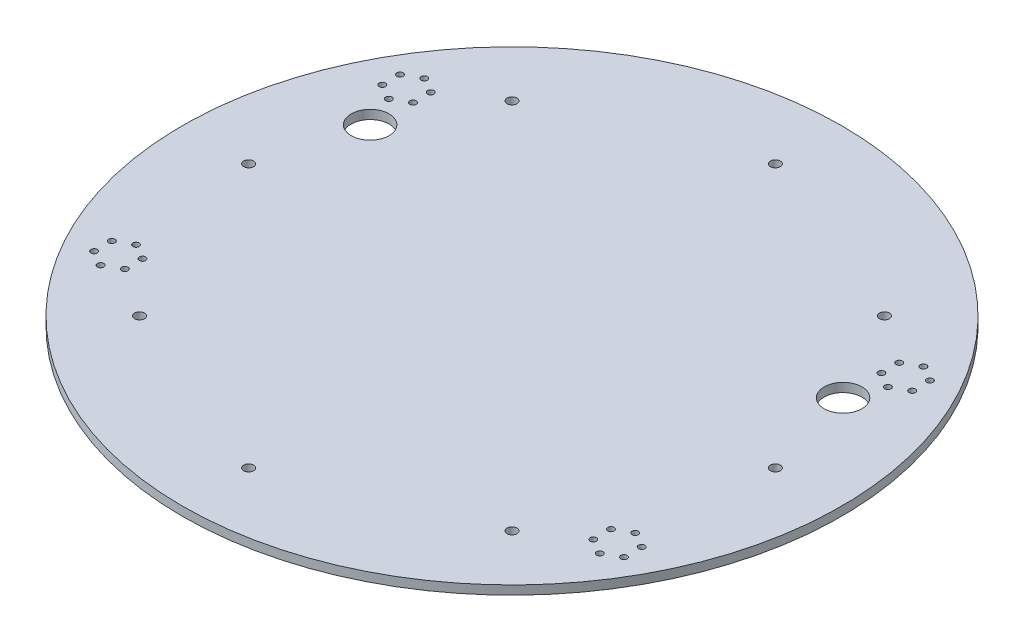
from build123d import *

# Parameters (mm, degrees)
SKETCH1_R           = 177
BOSS_EXTRUDE1_DEPTH = 4.7625
SKETCH2_R           = 1.7
CUT_EXTRUDE1_DEPTH  = 251.361102023
SKETCH3_R           = 2.667
ZIP_TIES_DEPTH      = 251.361102023
SKETCH4_R           = 10.16
WIRES_2_DEPTH       = 251.361102023


with BuildPart() as part:
    # Sketch1 → Boss-Extrude1 (new body)
    with BuildSketch(Plane(origin=(0, 0, 0), x_dir=(1, 0, 0), z_dir=(0, 1, 0))):
        with Locations(Location((0, 0, 0), (0, 0, 90))):
            Circle(SKETCH1_R)
    extrude(amount=BOSS_EXTRUDE1_DEPTH)

    # Sketch2 → Cut-Extrude1 (cut, through all)
    with BuildSketch(Plane(origin=(0, 4.7625, 0), x_dir=(1, 0, 0), z_dir=(0, 1, 0))):
        with Locations(Location((142.287973842, -82.15, 0), (0, 0, 270))):
            Circle(SKETCH2_R)
        with Locations(Location((134.039081871, -86.9125, 0), (0, 0, 270))):
            Circle(SKETCH2_R)
        with Locations(Location((125.7901899, -82.15, 0), (0, 0, 270))):
            Circle(SKETCH2_R)
        with Locations(Location((125.7901899, -72.625, 0), (0, 0, 270))):
            Circle(SKETCH2_R)
        with Locations(Location((134.039081871, -67.8625, 0), (0, 0, 270))):
            Circle(SKETCH2_R)
        with Locations(Location((142.287973842, -72.625, 0), (0, 0, 270))):
            Circle(SKETCH2_R)
        with Locations(Location((-142.287973842, -72.625, 0), (0, 0, 270))):
            Circle(SKETCH2_R)
        with Locations(Location((-134.039081871, -67.8625, 0), (0, 0, 270))):
            Circle(SKETCH2_R)
        with Locations(Location((-125.7901899, -72.625, 0), (0, 0, 270))):
            Circle(SKETCH2_R)
        with Locations(Location((-125.7901899, -82.15, 0), (0, 0, 270))):
            Circle(SKETCH2_R)
        with Locations(Location((-134.039081871, -86.9125, 0), (0, 0, 270))):
            Circle(SKETCH2_R)
        with Locations(Location((-142.287973842, -82.15, 0), (0, 0, 270))):
            Circle(SKETCH2_R)
        with Locations(Location((-142.287973842, 82.15, 0), (0, 0, 270))):
            Circle(SKETCH2_R)
        with Locations(Location((-134.039081871, 86.9125, 0), (0, 0, 270))):
            Circle(SKETCH2_R)
        with Locations(Location((-125.7901899, 82.15, 0), (0, 0, 270))):
            Circle(SKETCH2_R)
        with Locations(Location((-125.7901899, 72.625, 0), (0, 0, 270))):
            Circle(SKETCH2_R)
        with Locations(Location((-134.039081871, 67.8625, 0), (0, 0, 270))):
            Circle(SKETCH2_R)
        with Locations(Location((-142.287973842, 72.625, 0), (0, 0, 270))):
            Circle(SKETCH2_R)
        with Locations(Location((142.287973842, 72.625, 0), (0, 0, 270))):
            Circle(SKETCH2_R)
        with Locations(Location((134.039081871, 67.8625, 0), (0, 0, 270))):
            Circle(SKETCH2_R)
        with Locations(Location((125.7901899, 72.625, 0), (0, 0, 270))):
            Circle(SKETCH2_R)
        with Locations(Location((125.7901899, 82.15, 0), (0, 0, 270))):
            Circle(SKETCH2_R)
        with Locations(Location((134.039081871, 86.9125, 0), (0, 0, 270))):
            Circle(SKETCH2_R)
        with Locations(Location((142.287973842, 82.15, 0), (0, 0, 270))):
            Circle(SKETCH2_R)
    extrude(amount=-CUT_EXTRUDE1_DEPTH, mode=Mode.SUBTRACT)

    # Sketch3 → Zip Ties (cut, through all)
    with BuildSketch(Plane(origin=(0, 4.7625, 0), x_dir=(1, 0, 0), z_dir=(0, 1, 0))):
        with Locations(Location((0, -141.44, 0), (0, 0, 270))):
            Circle(SKETCH3_R)
        with Locations(Location((-100.013183131, -100.013183131, 0), (0, 0, 270))):
            Circle(SKETCH3_R)
        with Locations(Location((-141.44, 0, 0), (0, 0, 270))):
            Circle(SKETCH3_R)
        with Locations(Location((-100.013183131, 100.013183131, 0), (0, 0, 270))):
            Circle(SKETCH3_R)
        with Locations(Location((0, 141.44, 0), (0, 0, 270))):
            Circle(SKETCH3_R)
        with Locations(Location((100.013183131, 100.013183131, 0), (0, 0, 270))):
            Circle(SKETCH3_R)
        with Locations(Location((141.44, 0, 0), (0, 0, 270))):
            Circle(SKETCH3_R)
        with Locations(Location((100.013183131, -100.013183131, 0), (0, 0, 270))):
            Circle(SKETCH3_R)
    extrude(amount=-ZIP_TIES_DEPTH, mode=Mode.SUBTRACT)

    # Sketch4 → Wires 2 (cut, through all)
    with BuildSketch(Plane(origin=(0, 4.7625, 0), x_dir=(1, 0, 0), z_dir=(0, 1, 0))):
        with Locations(Location((-127, 50.8, 0), (0, 0, 270))):
            Circle(SKETCH4_R)
        with Locations(Location((127, 50.8, 0), (0, 0, 270))):
            Circle(SKETCH4_R)
    extrude(amount=-WIRES_2_DEPTH, mode=Mode.SUBTRACT)


solid = part.part
